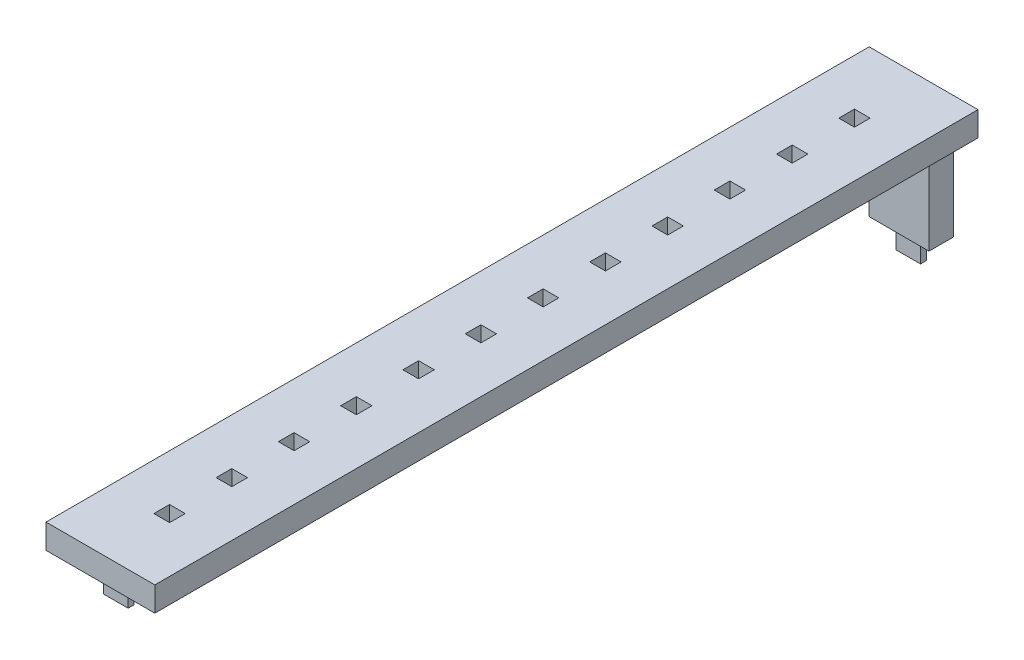
from build123d import *

# Parameters (mm, degrees)
SZKIC1_W                    = 4.44
SZKIC1_H                    = 33.58
DODANIE_WYCI_GNI_CIE1_DEPTH = 1
SZKIC2_W                    = 0.64
SZKIC2_H                    = 0.64
WYTNIJ_WYCI_GNI_CIE1_DEPTH  = 1
SZKIC3_W                    = 1
SZKIC3_H                    = 0.25
DODANIE_WYCI_GNI_CIE2_DEPTH = 1
SZKIC4_W                    = 4.44
SZKIC4_H                    = 1
DODANIE_WYCI_GNI_CIE3_DEPTH = 4
SZKIC5_W                    = 1
SZKIC5_H                    = 0.25
DODANIE_WYCI_GNI_CIE4_DEPTH = 1
SZKIC6_W                    = 1
SZKIC6_H                    = 1
WYTNIJ_WYCI_GNI_CIE2_DEPTH  = 4


with BuildPart() as part:
    # Szkic1 → Dodanie-wyciągnięcie1 (new body)
    with BuildSketch(Plane(origin=(0, 0, 0), x_dir=(1, 0, 0), z_dir=(0, 1, 0))):
        Rectangle(SZKIC1_W, SZKIC1_H)
    extrude(amount=DODANIE_WYCI_GNI_CIE1_DEPTH)

    # Szkic2 → Wytnij-wyciągnięcie1 (cut)
    with BuildSketch(Plane(origin=(0, 1, 0), x_dir=(1, 0, 0), z_dir=(0, 1, 0))):
        with Locations((0, -13.97)):
            Rectangle(SZKIC2_W, SZKIC2_H)
        with Locations((0, -11.43)):
            Rectangle(SZKIC2_W, SZKIC2_H)
        with Locations((0, -8.89)):
            Rectangle(SZKIC2_W, SZKIC2_H)
        with Locations((0, -6.35)):
            Rectangle(SZKIC2_W, SZKIC2_H)
        with Locations((0, -3.81)):
            Rectangle(SZKIC2_W, SZKIC2_H)
        with Locations((0, -1.27)):
            Rectangle(SZKIC2_W, SZKIC2_H)
        with Locations((0, 1.27)):
            Rectangle(SZKIC2_W, SZKIC2_H)
        with Locations((0, 3.81)):
            Rectangle(SZKIC2_W, SZKIC2_H)
        with Locations((0, 6.35)):
            Rectangle(SZKIC2_W, SZKIC2_H)
        with Locations((0, 8.89)):
            Rectangle(SZKIC2_W, SZKIC2_H)
        with Locations((0, 11.43)):
            Rectangle(SZKIC2_W, SZKIC2_H)
        with Locations((0, 13.97)):
            Rectangle(SZKIC2_W, SZKIC2_H)
    extrude(amount=-WYTNIJ_WYCI_GNI_CIE1_DEPTH, mode=Mode.SUBTRACT)

    # Szkic3 → Dodanie-wyciągnięcie2 (add)
    with BuildSketch(Plane.XZ):
        with Locations((0, 16.0350189)):
            Rectangle(SZKIC3_W, SZKIC3_H)
    extrude(amount=DODANIE_WYCI_GNI_CIE2_DEPTH)

    # Szkic4 → Dodanie-wyciągnięcie3 (add)
    with BuildSketch(Plane.XZ):
        with Locations((0, -16.29)):
            Rectangle(SZKIC4_W, SZKIC4_H)
    extrude(amount=DODANIE_WYCI_GNI_CIE3_DEPTH)

    # Szkic5 → Dodanie-wyciągnięcie4 (add)
    with BuildSketch(Plane.XZ.offset(4)):
        with Locations((0, -16.29)):
            Rectangle(SZKIC5_W, SZKIC5_H)
    extrude(amount=DODANIE_WYCI_GNI_CIE4_DEPTH)

    # Szkic6 → Wytnij-wyciągnięcie2 (cut)
    with BuildSketch(Plane.XZ.offset(4)):
        with Locations((1.72, -16.29)):
            Rectangle(SZKIC6_W, SZKIC6_H)
        with Locations((-1.72, -16.29)):
            Rectangle(SZKIC6_W, SZKIC6_H)
    extrude(amount=-WYTNIJ_WYCI_GNI_CIE2_DEPTH, mode=Mode.SUBTRACT)


solid = part.part
